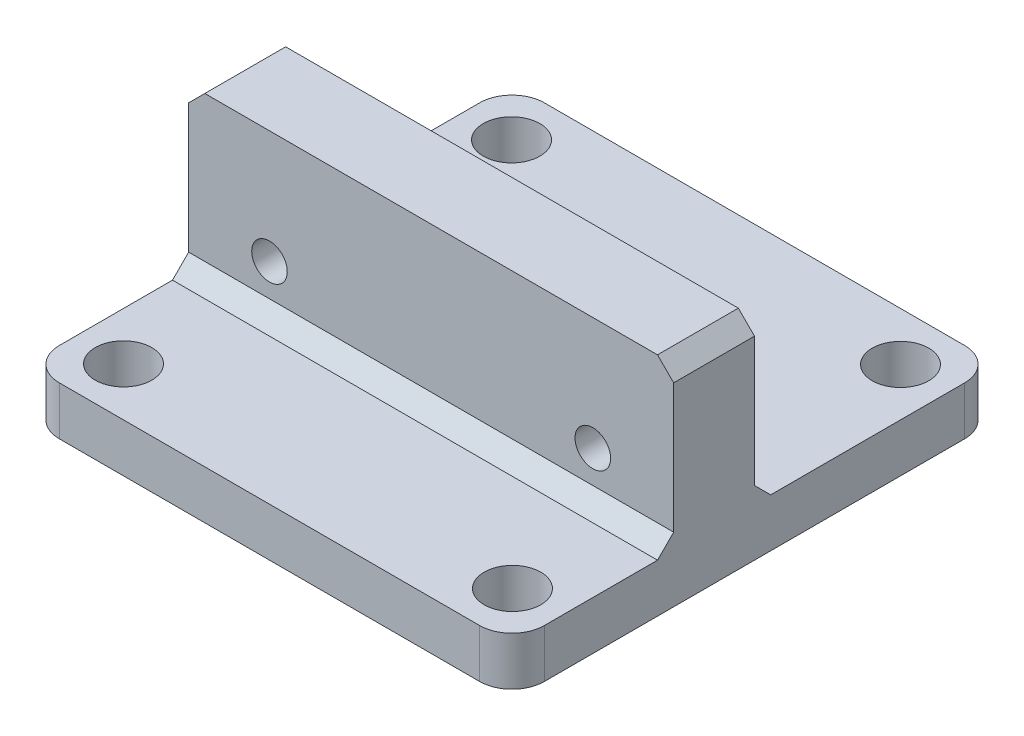
from build123d import *

# Parameters (mm, degrees)
BOSS_EXTRUDE1_DEPTH        = 15
F_3_5_3_5_DIAMETER_HOLE1_D = 3.5
FILLET1_R                  = 2
F_2_2_2_2_DIAMETER_HOLE1_D = 2.2
CHAMFER1_SIZE              = 1
CHAMFER2_SIZE              = 1


with BuildPart() as part:
    # Sketch1 → Boss-Extrude1 (new, symmetric)
    with BuildSketch(Plane(origin=(0, 0, 0), x_dir=(0, 0, -1), z_dir=(1, 0, 0))):
        Polygon((-15, 0), (15, 0), (15, 3), (0, 3), (0, 13), (-5, 13), (-5, 3), (-15, 3), align=None)
    extrude(amount=BOSS_EXTRUDE1_DEPTH, both=True)

    # Ø3.5 (3.5) Diameter Hole1 (through all)
    with Locations(Plane(origin=(0, 3, 0), x_dir=(1, 0, 0), z_dir=(0, 1, 0))):
        with Locations((-12.02948497, 12), (12.02948497, 12), (-12.02948497, -12), (12.02948497, -12)):
            Hole(F_3_5_3_5_DIAMETER_HOLE1_D / 2)

    # Fillet1
    fillet1_edges = [part.edges().sort_by_distance(p)[0] for p in [
        (-15, 1.5, -15),
        (15, 1.5, 15),
        (15, 1.5, -15),
        (-15, 1.5, 15),
    ]]
    fillet(fillet1_edges, radius=FILLET1_R)

    # Ø2.2 (2.2) Diameter Hole1 (through all)
    with Locations(Plane(origin=(0, 0, 0), x_dir=(-1, 0, 0), z_dir=(0, 0, -1))):
        with Locations((-10, 6), (10, 6)):
            Hole(F_2_2_2_2_DIAMETER_HOLE1_D / 2)

    # Chamfer1
    chamfer1_edges = [part.edges().sort_by_distance(p)[0] for p in [
        (0, 3, 5),
        (0, 3, 0),
    ]]
    chamfer(chamfer1_edges, length=CHAMFER1_SIZE)

    # Chamfer2
    chamfer2_edges = [part.edges().sort_by_distance(p)[0] for p in [
        (-15, 13, 2.5),
        (15, 13, 2.5),
    ]]
    chamfer(chamfer2_edges, length=CHAMFER2_SIZE)


solid = part.part
